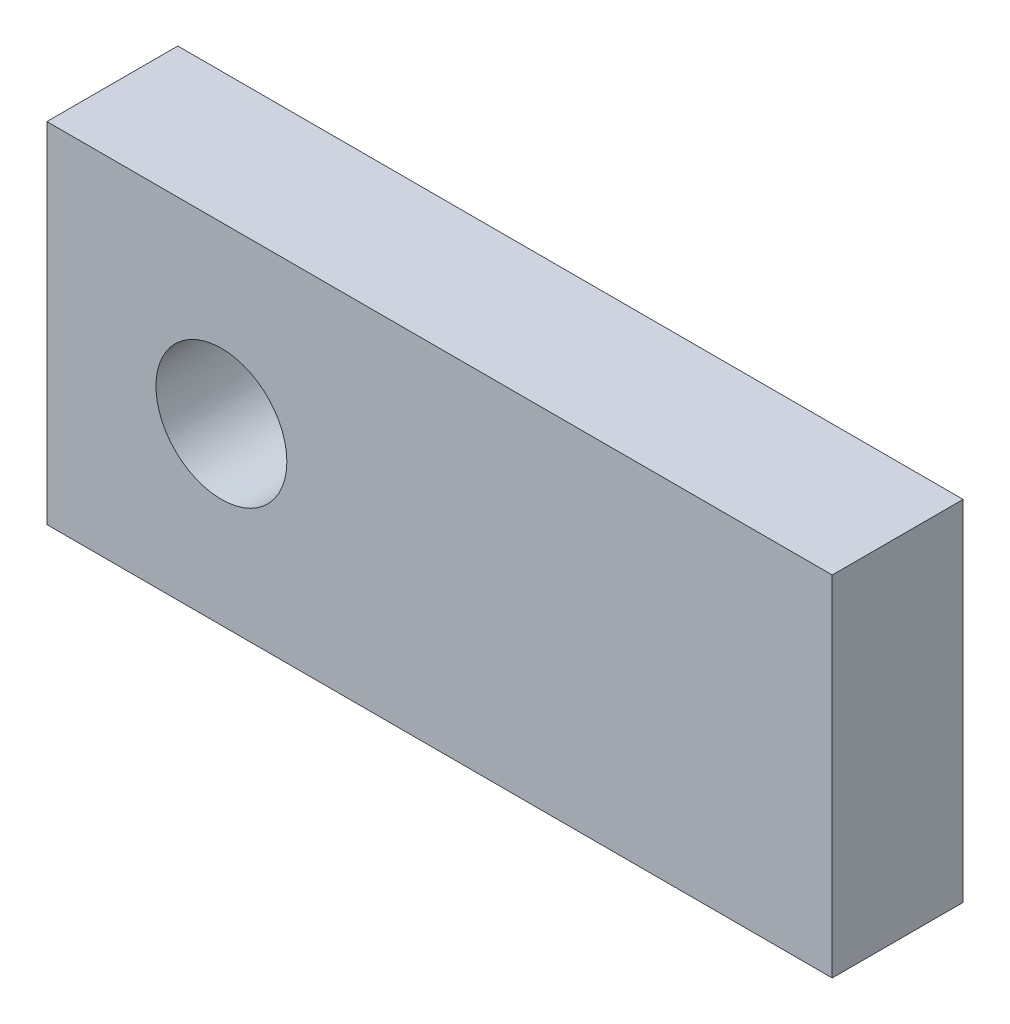
from build123d import *

# Parameters (mm, degrees)
SKETCH_1_W          = 18
SKETCH_1_H          = 8
EXTRUDE_1_DEPTH     = 3
SKETCH_2_R          = 1.5
CUT_EXTRUDE_1_DEPTH = 20.924858845


with BuildPart() as part:
    # Эскиз1 → Бобышка-Вытянуть1 (new body)
    with BuildSketch(Plane.XY):
        with Locations((9, 4)):
            Rectangle(SKETCH_1_W, SKETCH_1_H)
    extrude(amount=EXTRUDE_1_DEPTH)

    # Эскиз2 → Вырез-Вытянуть1 (cut, through all)
    with BuildSketch(Plane.XY.offset(3)):
        with Locations((4, 4)):
            Circle(SKETCH_2_R)
    extrude(amount=-CUT_EXTRUDE_1_DEPTH, mode=Mode.SUBTRACT)


solid = part.part
